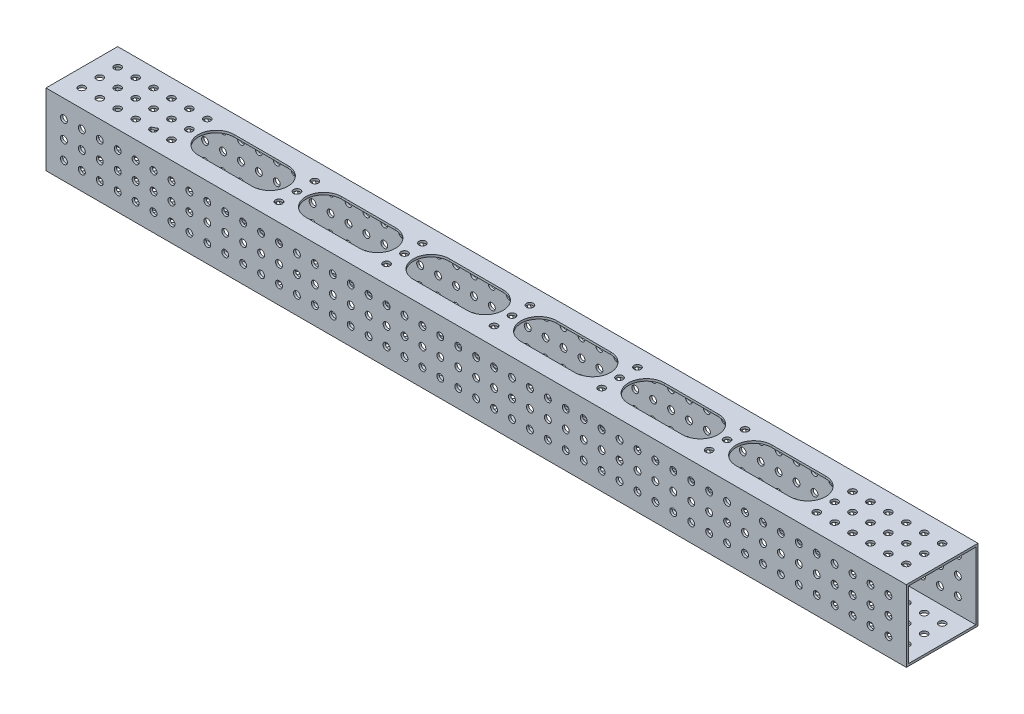
from build123d import *

# Parameters (mm, degrees)
SKETCH1_W           = 50.8
SKETCH1_H           = 50.8
SKETCH1_W_2         = 47.625
SKETCH1_H_2         = 47.625
BOSS_EXTRUDE1_DEPTH = 609.6
SKETCH2_R           = 2.4384
CUT_EXTRUDE2_DEPTH  = 609.6
SKETCH3_R           = 2.4384
CUT_EXTRUDE3_DEPTH  = 76.2


with BuildPart() as part:
    # Sketch1 → Boss-Extrude1 (new body)
    with BuildSketch(Plane(origin=(0, 0, 0), x_dir=(0, 0, -1), z_dir=(1, 0, 0))):
        Rectangle(SKETCH1_W, SKETCH1_H)
        Rectangle(SKETCH1_W_2, SKETCH1_H_2, mode=Mode.SUBTRACT)
    extrude(amount=BOSS_EXTRUDE1_DEPTH)

    # Sketch2 → Cut-Extrude2 (cut)
    with BuildSketch(Plane.XY.offset(25.4)):
        with Locations((12.7, 12.7)):
            Circle(SKETCH2_R)
        with Locations((12.7, 0)):
            Circle(SKETCH2_R)
        with Locations((12.7, -12.7)):
            Circle(SKETCH2_R)
        with Locations((25.4, 12.7)):
            Circle(SKETCH2_R)
        with Locations((25.4, 0)):
            Circle(SKETCH2_R)
        with Locations((25.4, -12.7)):
            Circle(SKETCH2_R)
        with Locations((38.1, 12.7)):
            Circle(SKETCH2_R)
        with Locations((38.1, 0)):
            Circle(SKETCH2_R)
        with Locations((38.1, -12.7)):
            Circle(SKETCH2_R)
        with Locations((50.8, 12.7)):
            Circle(SKETCH2_R)
        with Locations((50.8, 0)):
            Circle(SKETCH2_R)
        with Locations((50.8, -12.7)):
            Circle(SKETCH2_R)
        with Locations((63.5, 12.7)):
            Circle(SKETCH2_R)
        with Locations((63.5, 0)):
            Circle(SKETCH2_R)
        with Locations((63.5, -12.7)):
            Circle(SKETCH2_R)
        with Locations((76.2, 12.7)):
            Circle(SKETCH2_R)
        with Locations((76.2, 0)):
            Circle(SKETCH2_R)
        with Locations((76.2, -12.7)):
            Circle(SKETCH2_R)
        with Locations((88.9, 12.7)):
            Circle(SKETCH2_R)
        with Locations((88.9, 0)):
            Circle(SKETCH2_R)
        with Locations((88.9, -12.7)):
            Circle(SKETCH2_R)
        with Locations((101.6, 12.7)):
            Circle(SKETCH2_R)
        with Locations((101.6, 0)):
            Circle(SKETCH2_R)
        with Locations((101.6, -12.7)):
            Circle(SKETCH2_R)
        with Locations((114.3, 12.7)):
            Circle(SKETCH2_R)
        with Locations((114.3, 0)):
            Circle(SKETCH2_R)
        with Locations((114.3, -12.7)):
            Circle(SKETCH2_R)
        with Locations((127, 12.7)):
            Circle(SKETCH2_R)
        with Locations((127, 0)):
            Circle(SKETCH2_R)
        with Locations((127, -12.7)):
            Circle(SKETCH2_R)
        with Locations((139.7, 12.7)):
            Circle(SKETCH2_R)
        with Locations((139.7, 0)):
            Circle(SKETCH2_R)
        with Locations((139.7, -12.7)):
            Circle(SKETCH2_R)
        with Locations((152.4, 12.7)):
            Circle(SKETCH2_R)
        with Locations((152.4, 0)):
            Circle(SKETCH2_R)
        with Locations((152.4, -12.7)):
            Circle(SKETCH2_R)
        with Locations((165.1, 12.7)):
            Circle(SKETCH2_R)
        with Locations((165.1, 0)):
            Circle(SKETCH2_R)
        with Locations((165.1, -12.7)):
            Circle(SKETCH2_R)
        with Locations((177.8, 12.7)):
            Circle(SKETCH2_R)
        with Locations((177.8, 0)):
            Circle(SKETCH2_R)
        with Locations((177.8, -12.7)):
            Circle(SKETCH2_R)
        with Locations((190.5, 12.7)):
            Circle(SKETCH2_R)
        with Locations((190.5, 0)):
            Circle(SKETCH2_R)
        with Locations((190.5, -12.7)):
            Circle(SKETCH2_R)
        with Locations((203.2, 12.7)):
            Circle(SKETCH2_R)
        with Locations((203.2, 0)):
            Circle(SKETCH2_R)
        with Locations((203.2, -12.7)):
            Circle(SKETCH2_R)
        with Locations((215.9, 12.7)):
            Circle(SKETCH2_R)
        with Locations((215.9, 0)):
            Circle(SKETCH2_R)
        with Locations((215.9, -12.7)):
            Circle(SKETCH2_R)
        with Locations((228.6, 12.7)):
            Circle(SKETCH2_R)
        with Locations((228.6, 0)):
            Circle(SKETCH2_R)
        with Locations((228.6, -12.7)):
            Circle(SKETCH2_R)
        with Locations((241.3, 12.7)):
            Circle(SKETCH2_R)
        with Locations((241.3, 0)):
            Circle(SKETCH2_R)
        with Locations((241.3, -12.7)):
            Circle(SKETCH2_R)
        with Locations((254, 12.7)):
            Circle(SKETCH2_R)
        with Locations((254, 0)):
            Circle(SKETCH2_R)
        with Locations((254, -12.7)):
            Circle(SKETCH2_R)
        with Locations((266.7, 12.7)):
            Circle(SKETCH2_R)
        with Locations((266.7, 0)):
            Circle(SKETCH2_R)
        with Locations((266.7, -12.7)):
            Circle(SKETCH2_R)
        with Locations((279.4, 12.7)):
            Circle(SKETCH2_R)
        with Locations((279.4, 0)):
            Circle(SKETCH2_R)
        with Locations((279.4, -12.7)):
            Circle(SKETCH2_R)
        with Locations((292.1, 12.7)):
            Circle(SKETCH2_R)
        with Locations((292.1, 0)):
            Circle(SKETCH2_R)
        with Locations((292.1, -12.7)):
            Circle(SKETCH2_R)
        with Locations((304.8, 12.7)):
            Circle(SKETCH2_R)
        with Locations((304.8, 0)):
            Circle(SKETCH2_R)
        with Locations((304.8, -12.7)):
            Circle(SKETCH2_R)
        with Locations((317.5, 12.7)):
            Circle(SKETCH2_R)
        with Locations((317.5, 0)):
            Circle(SKETCH2_R)
        with Locations((317.5, -12.7)):
            Circle(SKETCH2_R)
        with Locations((330.2, 12.7)):
            Circle(SKETCH2_R)
        with Locations((330.2, 0)):
            Circle(SKETCH2_R)
        with Locations((330.2, -12.7)):
            Circle(SKETCH2_R)
        with Locations((342.9, 12.7)):
            Circle(SKETCH2_R)
        with Locations((342.9, 0)):
            Circle(SKETCH2_R)
        with Locations((342.9, -12.7)):
            Circle(SKETCH2_R)
        with Locations((355.6, 12.7)):
            Circle(SKETCH2_R)
        with Locations((355.6, 0)):
            Circle(SKETCH2_R)
        with Locations((355.6, -12.7)):
            Circle(SKETCH2_R)
        with Locations((368.3, 12.7)):
            Circle(SKETCH2_R)
        with Locations((368.3, 0)):
            Circle(SKETCH2_R)
        with Locations((368.3, -12.7)):
            Circle(SKETCH2_R)
        with Locations((381, 12.7)):
            Circle(SKETCH2_R)
        with Locations((381, 0)):
            Circle(SKETCH2_R)
        with Locations((381, -12.7)):
            Circle(SKETCH2_R)
        with Locations((393.7, 12.7)):
            Circle(SKETCH2_R)
        with Locations((393.7, 0)):
            Circle(SKETCH2_R)
        with Locations((393.7, -12.7)):
            Circle(SKETCH2_R)
        with Locations((406.4, 12.7)):
            Circle(SKETCH2_R)
        with Locations((406.4, 0)):
            Circle(SKETCH2_R)
        with Locations((406.4, -12.7)):
            Circle(SKETCH2_R)
        with Locations((419.1, 12.7)):
            Circle(SKETCH2_R)
        with Locations((419.1, 0)):
            Circle(SKETCH2_R)
        with Locations((419.1, -12.7)):
            Circle(SKETCH2_R)
        with Locations((431.8, 12.7)):
            Circle(SKETCH2_R)
        with Locations((431.8, 0)):
            Circle(SKETCH2_R)
        with Locations((431.8, -12.7)):
            Circle(SKETCH2_R)
        with Locations((444.5, 12.7)):
            Circle(SKETCH2_R)
        with Locations((444.5, 0)):
            Circle(SKETCH2_R)
        with Locations((444.5, -12.7)):
            Circle(SKETCH2_R)
        with Locations((457.2, 12.7)):
            Circle(SKETCH2_R)
        with Locations((457.2, 0)):
            Circle(SKETCH2_R)
        with Locations((457.2, -12.7)):
            Circle(SKETCH2_R)
        with Locations((469.9, 12.7)):
            Circle(SKETCH2_R)
        with Locations((469.9, 0)):
            Circle(SKETCH2_R)
        with Locations((469.9, -12.7)):
            Circle(SKETCH2_R)
        with Locations((482.6, 12.7)):
            Circle(SKETCH2_R)
        with Locations((482.6, 0)):
            Circle(SKETCH2_R)
        with Locations((482.6, -12.7)):
            Circle(SKETCH2_R)
        with Locations((495.3, 12.7)):
            Circle(SKETCH2_R)
        with Locations((495.3, 0)):
            Circle(SKETCH2_R)
        with Locations((495.3, -12.7)):
            Circle(SKETCH2_R)
        with Locations((508, 12.7)):
            Circle(SKETCH2_R)
        with Locations((508, 0)):
            Circle(SKETCH2_R)
        with Locations((508, -12.7)):
            Circle(SKETCH2_R)
        with Locations((520.7, 12.7)):
            Circle(SKETCH2_R)
        with Locations((520.7, 0)):
            Circle(SKETCH2_R)
        with Locations((520.7, -12.7)):
            Circle(SKETCH2_R)
        with Locations((533.4, 12.7)):
            Circle(SKETCH2_R)
        with Locations((533.4, 0)):
            Circle(SKETCH2_R)
        with Locations((533.4, -12.7)):
            Circle(SKETCH2_R)
        with Locations((546.1, 12.7)):
            Circle(SKETCH2_R)
        with Locations((546.1, 0)):
            Circle(SKETCH2_R)
        with Locations((546.1, -12.7)):
            Circle(SKETCH2_R)
        with Locations((558.8, 12.7)):
            Circle(SKETCH2_R)
        with Locations((558.8, 0)):
            Circle(SKETCH2_R)
        with Locations((558.8, -12.7)):
            Circle(SKETCH2_R)
        with Locations((571.5, 12.7)):
            Circle(SKETCH2_R)
        with Locations((571.5, 0)):
            Circle(SKETCH2_R)
        with Locations((571.5, -12.7)):
            Circle(SKETCH2_R)
        with Locations((584.2, 12.7)):
            Circle(SKETCH2_R)
        with Locations((584.2, 0)):
            Circle(SKETCH2_R)
        with Locations((584.2, -12.7)):
            Circle(SKETCH2_R)
        with Locations((596.9, 12.7)):
            Circle(SKETCH2_R)
        with Locations((596.9, 0)):
            Circle(SKETCH2_R)
        with Locations((596.9, -12.7)):
            Circle(SKETCH2_R)
    extrude(amount=-CUT_EXTRUDE2_DEPTH, mode=Mode.SUBTRACT)

    # Sketch3 → Cut-Extrude3 (cut)
    with BuildSketch(Plane.XZ.offset(25.4)):
        with BuildLine():
            ThreePointArc((400.05, 12.7), (387.35, 0), (400.05, -12.7))
            Line((400.05, -12.7), (438.15, -12.7))
            ThreePointArc((438.15, -12.7), (450.85, 0), (438.15, 12.7))
            Line((438.15, 12.7), (400.05, 12.7))
        make_face()
        with Locations(Location((381, 0, 0), (0, 0, 270))):
            Circle(SKETCH3_R)
        with BuildLine():
            ThreePointArc((323.85, 12.7), (311.15, 0), (323.85, -12.7))
            Line((323.85, -12.7), (361.95, -12.7))
            ThreePointArc((361.95, -12.7), (374.65, 0), (361.95, 12.7))
            Line((361.95, 12.7), (323.85, 12.7))
        make_face()
        with Locations(Location((304.8, 0, 0), (0, 0, 270))):
            Circle(SKETCH3_R)
        with BuildLine():
            ThreePointArc((247.65, 12.7), (234.95, 0), (247.65, -12.7))
            Line((247.65, -12.7), (285.75, -12.7))
            ThreePointArc((285.75, -12.7), (298.45, 0), (285.75, 12.7))
            Line((285.75, 12.7), (247.65, 12.7))
        make_face()
        with Locations(Location((228.6, 0, 0), (0, 0, 270))):
            Circle(SKETCH3_R)
        with BuildLine():
            ThreePointArc((171.45, 12.7), (158.75, 0), (171.45, -12.7))
            Line((171.45, -12.7), (209.55, -12.7))
            ThreePointArc((209.55, -12.7), (222.25, 0), (209.55, 12.7))
            Line((209.55, 12.7), (171.45, 12.7))
        make_face()
        with Locations(Location((152.4, 0, 0), (0, 0, 270))):
            Circle(SKETCH3_R)
        with BuildLine():
            ThreePointArc((95.25, 12.7), (82.55, 0), (95.25, -12.7))
            Line((95.25, -12.7), (133.35, -12.7))
            ThreePointArc((133.35, -12.7), (146.05, 0), (133.35, 12.7))
            Line((133.35, 12.7), (95.25, 12.7))
        make_face()
        with Locations(Location((76.2, 0, 0), (0, 0, 270))):
            Circle(SKETCH3_R)
        with Locations(Location((50.8, 12.7, 0), (0, 0, 270))):
            Circle(SKETCH3_R)
        with BuildLine():
            ThreePointArc((64.394018317, 10.431404441), (64.590485631, 14.880971263), (61.148712563, 12.054057319))
            ThreePointArc((61.148712563, 12.054057319), (62.829612663, 11.359225326), (64.394018317, 10.431404441))
        make_face()
        with Locations(Location((38.1, 12.7, 0), (0, 0, 270))):
            Circle(SKETCH3_R)
        with Locations(Location((25.4, 12.7, 0), (0, 0, 270))):
            Circle(SKETCH3_R)
        with Locations(Location((63.5, -12.7, 0), (0, 0, 270))):
            Circle(SKETCH3_R)
        with Locations(Location((12.7, 12.7, 0), (0, 0, 270))):
            Circle(SKETCH3_R)
        with Locations(Location((50.8, -12.7, 0), (0, 0, 270))):
            Circle(SKETCH3_R)
        with Locations(Location((38.1, -12.7, 0), (0, 0, 270))):
            Circle(SKETCH3_R)
        with Locations(Location((12.7, -12.7, 0), (0, 0, 270))):
            Circle(SKETCH3_R)
        with Locations(Location((25.4, -12.7, 0), (0, 0, 270))):
            Circle(SKETCH3_R)
        with Locations(Location((533.4, 0, 0), (0, 0, 270))):
            Circle(SKETCH3_R)
        with Locations(Location((457.2, 0, 0), (0, 0, 270))):
            Circle(SKETCH3_R)
        with BuildLine():
            Line((514.35, 12.7), (476.25, 12.7))
            ThreePointArc((476.25, 12.7), (463.55, 0), (476.25, -12.7))
            Line((476.25, -12.7), (514.35, -12.7))
            ThreePointArc((514.35, -12.7), (527.05, 0), (514.35, 12.7))
        make_face()
        with Locations(Location((546.1, 12.7, 0), (0, 0, 270))):
            Circle(SKETCH3_R)
        with Locations(Location((546.1, -12.7, 0), (0, 0, 270))):
            Circle(SKETCH3_R)
        with Locations(Location((558.8, 12.7, 0), (0, 0, 270))):
            Circle(SKETCH3_R)
        with Locations(Location((558.8, -12.7, 0), (0, 0, 270))):
            Circle(SKETCH3_R)
        with Locations(Location((571.5, 12.7, 0), (0, 0, 270))):
            Circle(SKETCH3_R)
        with Locations(Location((571.5, -12.7, 0), (0, 0, 270))):
            Circle(SKETCH3_R)
        with Locations(Location((584.2, 12.7, 0), (0, 0, 270))):
            Circle(SKETCH3_R)
        with Locations(Location((584.2, -12.7, 0), (0, 0, 270))):
            Circle(SKETCH3_R)
        with Locations(Location((596.9, 12.7, 0), (0, 0, 270))):
            Circle(SKETCH3_R)
        with Locations(Location((596.9, -12.7, 0), (0, 0, 270))):
            Circle(SKETCH3_R)
        with Locations(Location((76.2, 12.7, 0), (0, 0, 270))):
            Circle(SKETCH3_R)
        with Locations(Location((76.2, -12.7, 0), (0, 0, 270))):
            Circle(SKETCH3_R)
        with Locations(Location((152.4, 12.7, 0), (0, 0, 270))):
            Circle(SKETCH3_R)
        with Locations(Location((152.4, -12.7, 0), (0, 0, 270))):
            Circle(SKETCH3_R)
        with Locations(Location((228.6, 12.7, 0), (0, 0, 270))):
            Circle(SKETCH3_R)
        with Locations(Location((228.6, -12.7, 0), (0, 0, 270))):
            Circle(SKETCH3_R)
        with Locations(Location((304.8, 12.7, 0), (0, 0, 270))):
            Circle(SKETCH3_R)
        with Locations(Location((304.8, -12.7, 0), (0, 0, 270))):
            Circle(SKETCH3_R)
        with Locations(Location((381, 12.7, 0), (0, 0, 270))):
            Circle(SKETCH3_R)
        with Locations(Location((381, -12.7, 0), (0, 0, 270))):
            Circle(SKETCH3_R)
        with Locations(Location((457.2, 12.7, 0), (0, 0, 270))):
            Circle(SKETCH3_R)
        with Locations(Location((457.2, -12.7, 0), (0, 0, 270))):
            Circle(SKETCH3_R)
        with Locations(Location((533.4, 12.7, 0), (0, 0, 270))):
            Circle(SKETCH3_R)
        with Locations(Location((533.4, -12.7, 0), (0, 0, 270))):
            Circle(SKETCH3_R)
        with Locations(Location((546.1, 0, 0), (0, 0, 270))):
            Circle(SKETCH3_R)
        with Locations(Location((558.8, 0, 0), (0, 0, 270))):
            Circle(SKETCH3_R)
        with Locations(Location((571.5, 0, 0), (0, 0, 270))):
            Circle(SKETCH3_R)
        with Locations(Location((584.2, 0, 0), (0, 0, 270))):
            Circle(SKETCH3_R)
        with Locations(Location((596.9, 0, 0), (0, 0, 270))):
            Circle(SKETCH3_R)
        with Locations(Location((63.5, 0, 0), (0, 0, 270))):
            Circle(SKETCH3_R)
        with Locations(Location((50.8, 0, 0), (0, 0, 270))):
            Circle(SKETCH3_R)
        with Locations(Location((38.1, 0, 0), (0, 0, 270))):
            Circle(SKETCH3_R)
        with Locations(Location((25.4, 0, 0), (0, 0, 270))):
            Circle(SKETCH3_R)
        with Locations(Location((12.7, 0, 0), (0, 0, 270))):
            Circle(SKETCH3_R)
    extrude(amount=-CUT_EXTRUDE3_DEPTH, mode=Mode.SUBTRACT)


solid = part.part
